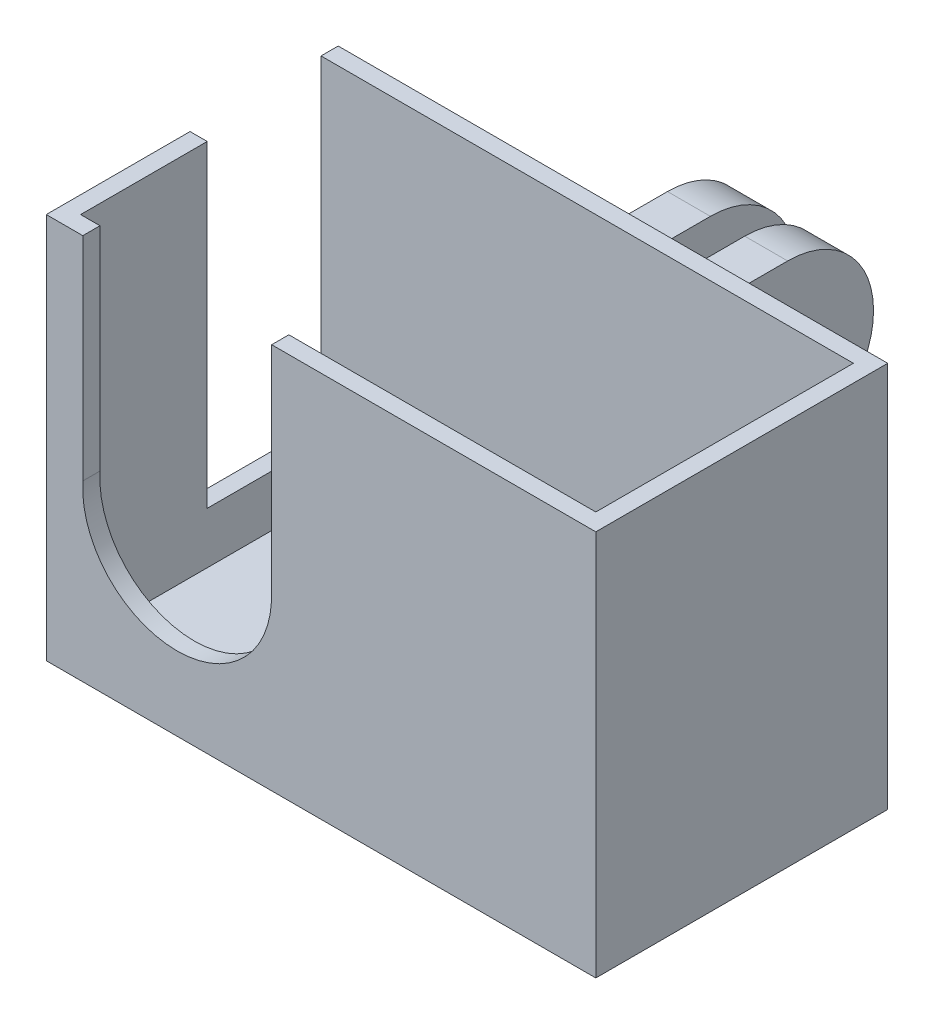
from build123d import *

# Parameters (mm, degrees)
SKETCH1_W           = 64
SKETCH1_H           = 45
BOSS_EXTRUDE1_DEPTH = 34
CUT_EXTRUDE2_START  = -2
SKETCH3_W           = 60
SKETCH3_H           = 41
CUT_EXTRUDE2_DEPTH  = 27
SKETCH4_W           = 60
SKETCH4_H           = 30
CUT_EXTRUDE3_DEPTH  = 43
BOSS_EXTRUDE2_START = 2
BOSS_EXTRUDE2_DEPTH = 5
BOSS_EXTRUDE3_START = -7
BOSS_EXTRUDE3_DEPTH = 5
SKETCH10_W          = 15.255500618
SKETCH10_H          = 37
CUT_EXTRUDE5_DEPTH  = 2
SKETCH15_W          = 22
SKETCH15_H          = 26
CUT_EXTRUDE6_DEPTH  = 10
SKETCH20_R          = 11
CUT_EXTRUDE7_DEPTH  = 10


with BuildPart() as part:
    # Sketch1 → Boss-Extrude1 (new body)
    with BuildSketch(Plane.XY):
        with Locations((1.653781513, -3.994957983)):
            Rectangle(SKETCH1_W, SKETCH1_H)
    extrude(amount=BOSS_EXTRUDE1_DEPTH)

    # Sketch3 → Cut-Extrude2 (cut)
    with BuildSketch(Plane.XY.offset(34).offset(CUT_EXTRUDE2_START)):
        with Locations((1.653781513, -3.994957983)):
            Rectangle(SKETCH3_W, SKETCH3_H)
    extrude(amount=-CUT_EXTRUDE2_DEPTH, mode=Mode.SUBTRACT)

    # Sketch4 → Cut-Extrude3 (cut)
    with BuildSketch(Plane(origin=(0, 18.505042017, 0), x_dir=(1, 0, 0), z_dir=(0, 1, 0))):
        with Locations((1.653781513, -17)):
            Rectangle(SKETCH4_W, SKETCH4_H)
    extrude(amount=-CUT_EXTRUDE3_DEPTH, mode=Mode.SUBTRACT)

    # Sketch7 → Boss-Extrude2 (add)
    with BuildSketch(Plane(origin=(0, 0, 0), x_dir=(0, 0, -1), z_dir=(1, 0, 0)).offset(BOSS_EXTRUDE2_START)):
        with BuildLine():
            Line((0, 7.999642933), (15, 7.999642933))
            ThreePointArc((15, 7.999642933), (25, -2.000357067), (15, -12.000357067))
            Line((15, -12.000357067), (0, -12.000357067))
            Line((0, -12.000357067), (0, 7.999642933))
        make_face()
    extrude(amount=BOSS_EXTRUDE2_DEPTH)

    # Sketch8 → Boss-Extrude3 (add)
    with BuildSketch(Plane(origin=(0, 0, 0), x_dir=(0, 0, -1), z_dir=(1, 0, 0)).offset(BOSS_EXTRUDE3_START)):
        with BuildLine():
            Line((0, -12.000357067), (0, 7.999642933))
            Line((0, 7.999642933), (15, 7.999642933))
            ThreePointArc((15, 7.999642933), (25, -2.000357067), (15, -12.000357067))
            Line((15, -12.000357067), (0, -12.000357067))
        make_face()
    extrude(amount=BOSS_EXTRUDE3_DEPTH)

    # Sketch10 → Cut-Extrude5 (cut)
    with BuildSketch(Plane.ZY.offset(30.346218487)):
        with Locations((9.627750309, 0.005042017)):
            Rectangle(SKETCH10_W, SKETCH10_H)
    extrude(amount=-CUT_EXTRUDE5_DEPTH, mode=Mode.SUBTRACT)

    # Sketch15 → Cut-Extrude6 (cut)
    with BuildSketch(Plane.XY.offset(34)):
        with Locations((-15.092768172, 5.505042017)):
            Rectangle(SKETCH15_W, SKETCH15_H)
    extrude(amount=-CUT_EXTRUDE6_DEPTH, mode=Mode.SUBTRACT)

    # Sketch20 → Cut-Extrude7 (cut)
    with BuildSketch(Plane.XY.offset(34)):
        with Locations((-15.112148053, -6.889817492)):
            Circle(SKETCH20_R)
    extrude(amount=-CUT_EXTRUDE7_DEPTH, mode=Mode.SUBTRACT)


solid = part.part
